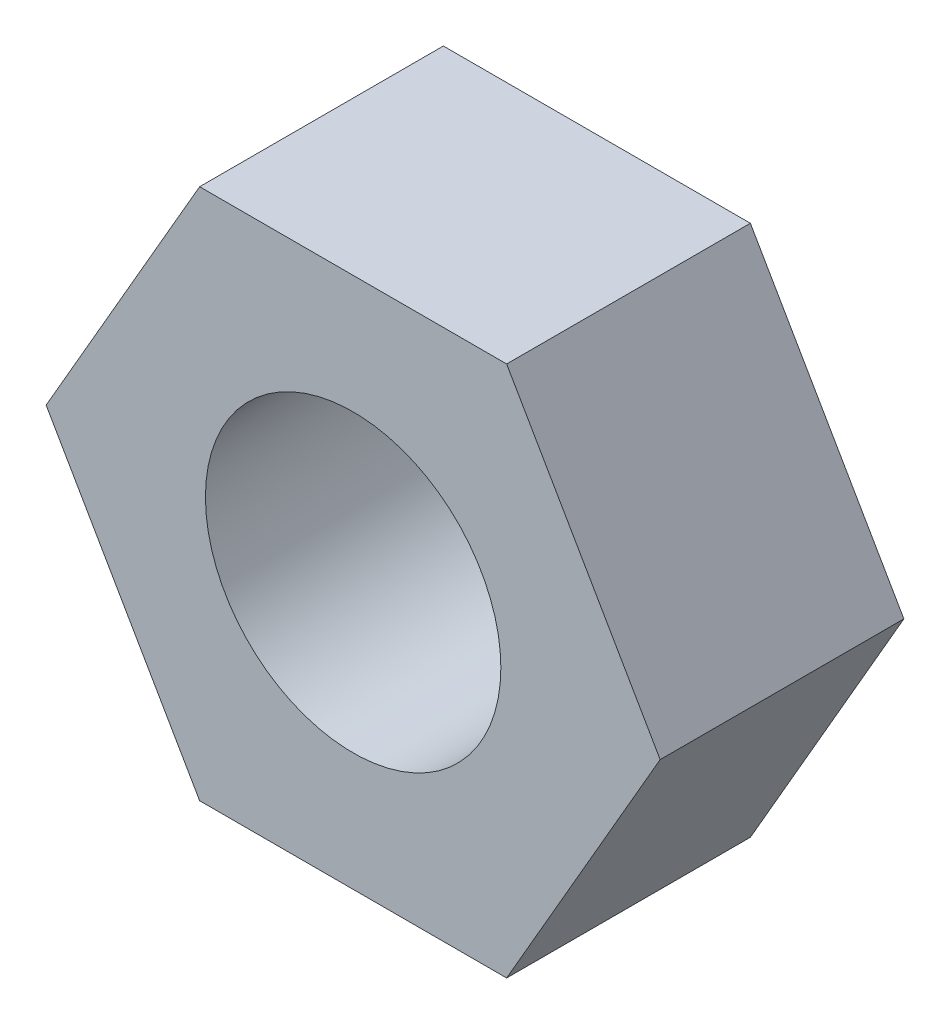
from build123d import *

# Parameters (mm, degrees)
SKETCH1_R           = 2
BOSS_EXTRUDE1_DEPTH = 3.3


with BuildPart() as part:
    # Sketch1 → Boss-Extrude1 (new body)
    with BuildSketch(Plane.XY):
        Polygon((4.156921938, 0), (2.078460969, 3.6), (-2.078460969, 3.6), (-4.156921938, 0), (-2.078460969, -3.6), (2.078460969, -3.6), align=None)
        Circle(SKETCH1_R, mode=Mode.SUBTRACT)
    extrude(amount=BOSS_EXTRUDE1_DEPTH)


solid = part.part
